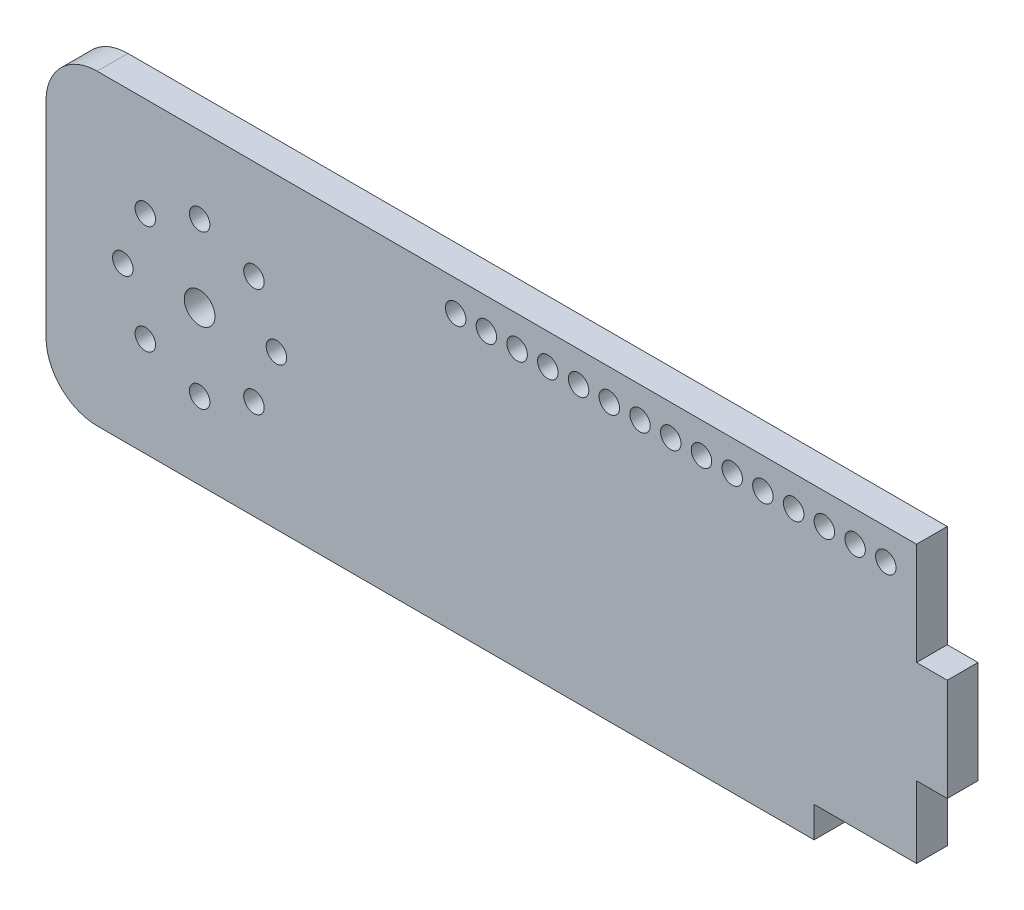
from build123d import *

# Parameters (mm, degrees)
SKETCH1_R           = 1.5
SKETCH1_R_2         = 1
BOSS_EXTRUDE1_DEPTH = 3
FILLET1_R           = 5


with BuildPart() as part:
    # Sketch1 → Boss-Extrude1 (new body)
    with BuildSketch(Plane.XY):
        Polygon((85, 30), (85, 20), (88, 20), (88, 10), (85, 10), (85, 3), (75, 3), (75, 0), (0, 0), (0, 30), align=None)
        with Locations((15, 15)):
            Circle(SKETCH1_R, mode=Mode.SUBTRACT)
        with Locations((7.5, 15)):
            Circle(SKETCH1_R_2, mode=Mode.SUBTRACT)
        with Locations((9.696699141, 20.303300859)):
            Circle(SKETCH1_R_2, mode=Mode.SUBTRACT)
        with Locations((15, 22.5)):
            Circle(SKETCH1_R_2, mode=Mode.SUBTRACT)
        with Locations((20.303300859, 20.303300859)):
            Circle(SKETCH1_R_2, mode=Mode.SUBTRACT)
        with Locations((22.5, 15)):
            Circle(SKETCH1_R_2, mode=Mode.SUBTRACT)
        with Locations((20.303300859, 9.696699141)):
            Circle(SKETCH1_R_2, mode=Mode.SUBTRACT)
        with Locations((15, 7.5)):
            Circle(SKETCH1_R_2, mode=Mode.SUBTRACT)
        with Locations((9.696699141, 9.696699141)):
            Circle(SKETCH1_R_2, mode=Mode.SUBTRACT)
        with Locations((82, 27)):
            Circle(SKETCH1_R_2, mode=Mode.SUBTRACT)
        with Locations((79, 27)):
            Circle(SKETCH1_R_2, mode=Mode.SUBTRACT)
        with Locations((76, 27)):
            Circle(SKETCH1_R_2, mode=Mode.SUBTRACT)
        with Locations((73, 27)):
            Circle(SKETCH1_R_2, mode=Mode.SUBTRACT)
        with Locations((70, 27)):
            Circle(SKETCH1_R_2, mode=Mode.SUBTRACT)
        with Locations((67, 27)):
            Circle(SKETCH1_R_2, mode=Mode.SUBTRACT)
        with Locations((64, 27)):
            Circle(SKETCH1_R_2, mode=Mode.SUBTRACT)
        with Locations((61, 27)):
            Circle(SKETCH1_R_2, mode=Mode.SUBTRACT)
        with Locations((58, 27)):
            Circle(SKETCH1_R_2, mode=Mode.SUBTRACT)
        with Locations((55, 27)):
            Circle(SKETCH1_R_2, mode=Mode.SUBTRACT)
        with Locations((52, 27)):
            Circle(SKETCH1_R_2, mode=Mode.SUBTRACT)
        with Locations((49, 27)):
            Circle(SKETCH1_R_2, mode=Mode.SUBTRACT)
        with Locations((46, 27)):
            Circle(SKETCH1_R_2, mode=Mode.SUBTRACT)
        with Locations((43, 27)):
            Circle(SKETCH1_R_2, mode=Mode.SUBTRACT)
        with Locations((40, 27)):
            Circle(SKETCH1_R_2, mode=Mode.SUBTRACT)
    extrude(amount=BOSS_EXTRUDE1_DEPTH)

    # Fillet1
    fillet1_edges = [part.edges().sort_by_distance(p)[0] for p in [
        (0, 0, 1.5),
        (0, 30, 1.5),
    ]]
    fillet(fillet1_edges, radius=FILLET1_R)


solid = part.part
